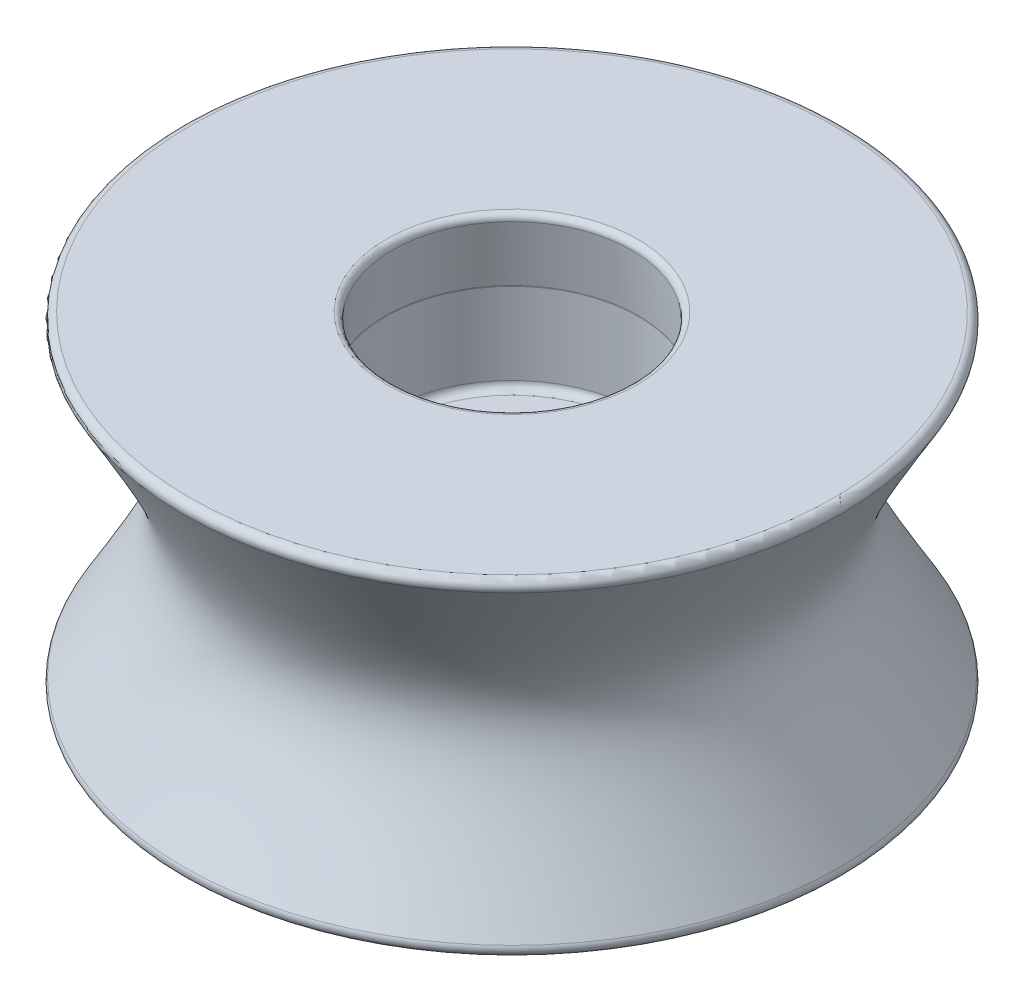
from build123d import *

# Parameters (mm, degrees)
SKETCH2_R          = 4
CUT_EXTRUDE1_DEPTH = 39.684622441
FILLET1_R          = 0.5
FILLET2_R          = 0.4


with BuildPart() as part:
    # Sketch1 → Revolve1 (revolve)
    with BuildSketch(Plane(origin=(0, 0, 0), x_dir=(0, 0, -1), z_dir=(1, 0, 0))):
        with BuildLine():
            Line((-22.5, 0), (0, 0))
            Line((0, 0), (0, 11.5))
            Line((0, 11.5), (-8.5, 11.5))
            Line((-8.5, 11.5), (-8.5, 17.5))
            Line((-8.5, 17.5), (-8, 22))
            Line((-8, 22), (-22.5, 22))
            add(Edge.make_bspline(
                [(-22.5, 22), (-16, 11), (-22.5, 0)],
                knots=[0, 0, 0, 1, 1, 1], degree=2, weights=[1, 3.505030536, 1]))
        make_face()
    revolve(axis=Axis((0, 39.130434783, 0), (0, -1, 0)))

    # Sketch2 → Cut-Extrude1 (cut, through all)
    with BuildSketch(Plane.XZ):
        Circle(SKETCH2_R)
    extrude(amount=-CUT_EXTRUDE1_DEPTH, mode=Mode.SUBTRACT)

    # Fillet1
    fillet1_edges = [part.edges().sort_by_distance(p)[0] for p in [
        (-4, 11.5, 0),
        (-4, 0, 0),
        (0, 11.5, -8.5),
        (0, 17.5, -8.5),
        (0, 0, -22.5),
        (0, 22, -22.5),
    ]]
    fillet(fillet1_edges, radius=FILLET1_R)

    # Fillet2
    fillet2_edges = [part.edges().sort_by_distance(p)[0] for p in [
        (0, 22, -8),
    ]]
    fillet(fillet2_edges, radius=FILLET2_R)


solid = part.part
